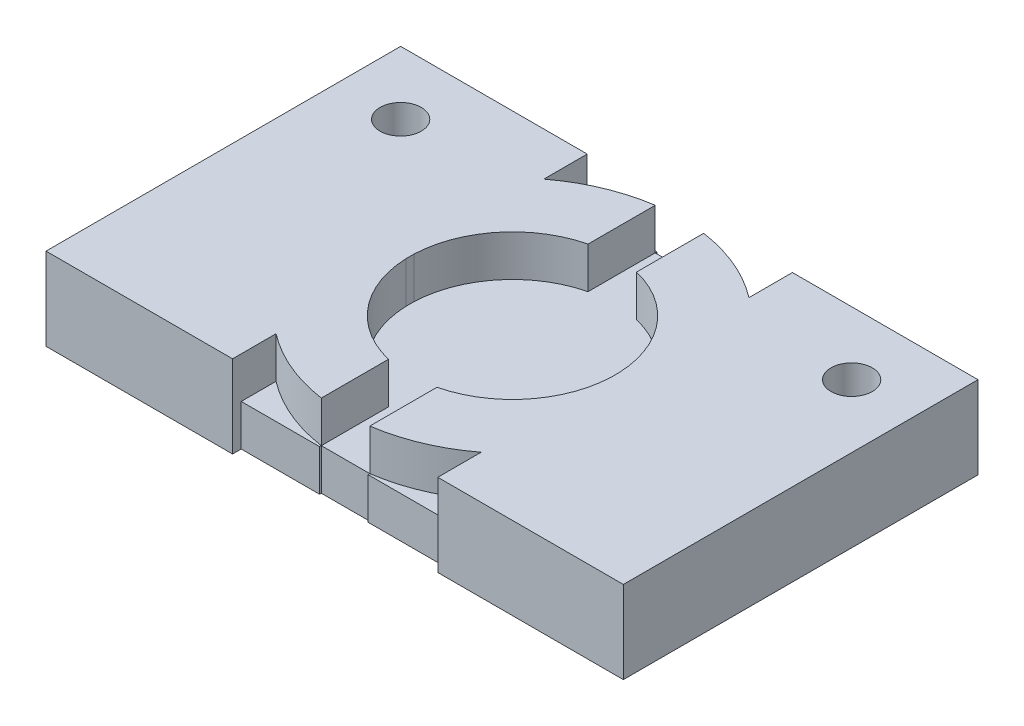
from build123d import *

# Parameters (mm, degrees)
SKETCH_1_W           = 70
SKETCH_1_H           = 43
EXTRUDE_1_DEPTH      = 10
SKETCH_4_R           = 2.5
CUT_EXTRUDE_1_DEPTH  = 10
SKETCH_5_R           = 2.5
CUT_EXTRUDE_2_DEPTH  = 10
SKETCH_8_W           = 24.88
SKETCH_8_H           = 5
CUT_EXTRUDE_4_DEPTH  = 57.338264084
SKETCH_11_R          = 20.45
SKETCH_11_R_2        = 12.45
EXTRUDE_1_2_DEPTH    = 5
CUT_EXTRUDE_6_DEPTH  = 5
CUT_EXTRUDE_7_DEPTH  = 5
SKETCH_16_W          = 5.88
SKETCH_16_H          = 11
CUT_EXTRUDE_8_DEPTH  = 5
SKETCH_17_W          = 5.88
SKETCH_17_H          = 8.352111755
CUT_EXTRUDE_9_DEPTH  = 5
CUT_EXTRUDE_10_DEPTH = 5
CUT_EXTRUDE_11_DEPTH = 5


with BuildPart() as part:
    # 草圖1 → Extrude 1 (new body)
    with BuildSketch(Plane(origin=(0, 0, 0), x_dir=(1, 0, 0), z_dir=(0, 1, 0))):
        Rectangle(SKETCH_1_W, SKETCH_1_H)
    extrude(amount=EXTRUDE_1_DEPTH)

    # 草圖4 → 除料-伸長1 (cut)
    with BuildSketch(Plane(origin=(0, 10, 0), x_dir=(1, 0, 0), z_dir=(0, 1, 0))):
        with Locations(Location((-27.34, 13.84, 0), (0, 0, 270))):
            Circle(SKETCH_4_R)
    extrude(amount=-CUT_EXTRUDE_1_DEPTH, mode=Mode.SUBTRACT)

    # 草圖5 → 除料-伸長2 (cut)
    with BuildSketch(Plane(origin=(0, 10, 0), x_dir=(1, 0, 0), z_dir=(0, 1, 0))):
        with Locations(Location((27.34, 13.84, 0), (0, 0, 270))):
            Circle(SKETCH_5_R)
    extrude(amount=-CUT_EXTRUDE_2_DEPTH, mode=Mode.SUBTRACT)

    # 草圖8 → 除料-伸長4 (cut, through all)
    with BuildSketch(Plane.XY.offset(21.5)):
        with Locations((0.06, 7.5)):
            Rectangle(SKETCH_8_W, SKETCH_8_H)
    extrude(amount=-CUT_EXTRUDE_4_DEPTH, mode=Mode.SUBTRACT)

    # 草圖11 → Extrude 1 2 (add)
    with BuildSketch(Plane(origin=(0, 5, 0), x_dir=(1, 0, 0), z_dir=(0, 1, 0))):
        with Locations((0.06, 0)):
            Circle(SKETCH_11_R)
        with Locations((0.06, 0)):
            Circle(SKETCH_11_R_2, mode=Mode.SUBTRACT)
    extrude(amount=EXTRUDE_1_2_DEPTH)

    # 草圖14 → 除料-伸長6 (cut)
    with BuildSketch(Plane(origin=(0, 5, 0), x_dir=(1, 0, 0), z_dir=(0, 1, 0))):
        Polygon((0.06, -20.45), (12.5, -20.45), (12.5, -21.5), (-12.38, -21.5), (-12.38, -20.45), align=None)
    extrude(amount=-CUT_EXTRUDE_6_DEPTH, mode=Mode.SUBTRACT)

    # 草圖15 → 除料-伸長7 (cut)
    with BuildSketch(Plane(origin=(0, 5, 0), x_dir=(1, 0, 0), z_dir=(0, 1, 0))):
        Polygon((0.06, 20.45), (12.5, 20.45), (12.5, 21.5), (-12.38, 21.5), (-12.38, 20.45), align=None)
    extrude(amount=-CUT_EXTRUDE_7_DEPTH, mode=Mode.SUBTRACT)

    # 草圖16 → 除料-伸長8 (cut)
    with BuildSketch(Plane(origin=(0, 10, 0), x_dir=(1, 0, 0), z_dir=(0, 1, 0))):
        with Locations((0.06, 17.597888245)):
            Rectangle(SKETCH_16_W, SKETCH_16_H)
    extrude(amount=-CUT_EXTRUDE_8_DEPTH, mode=Mode.SUBTRACT)

    # 草圖17 → 除料-伸長9 (cut)
    with BuildSketch(Plane(origin=(0, 10, 0), x_dir=(1, 0, 0), z_dir=(0, 1, 0))):
        with Locations((0.06, -16.273944123)):
            Rectangle(SKETCH_17_W, SKETCH_17_H)
    extrude(amount=-CUT_EXTRUDE_9_DEPTH, mode=Mode.SUBTRACT)

    # 草圖19 → 除料-伸長10 (cut)
    with BuildSketch(Plane(origin=(0, 5, 0), x_dir=(1, 0, 0), z_dir=(0, 1, 0))):
        Polygon((-2.88, 20.237561612), (-2.88, 20.45), (2.98755849, 20.45), (3, 20.237561612), align=None)
    extrude(amount=-CUT_EXTRUDE_10_DEPTH, mode=Mode.SUBTRACT)

    # 草圖20 → 除料-伸長11 (cut)
    with BuildSketch(Plane(origin=(0, 5, 0), x_dir=(1, 0, 0), z_dir=(0, 1, 0))):
        Polygon((3, -20.237561612), (3, -20.45), (-2.887827835, -20.45), (-2.88, -20.237561612), align=None)
    extrude(amount=-CUT_EXTRUDE_11_DEPTH, mode=Mode.SUBTRACT)


solid = part.part
